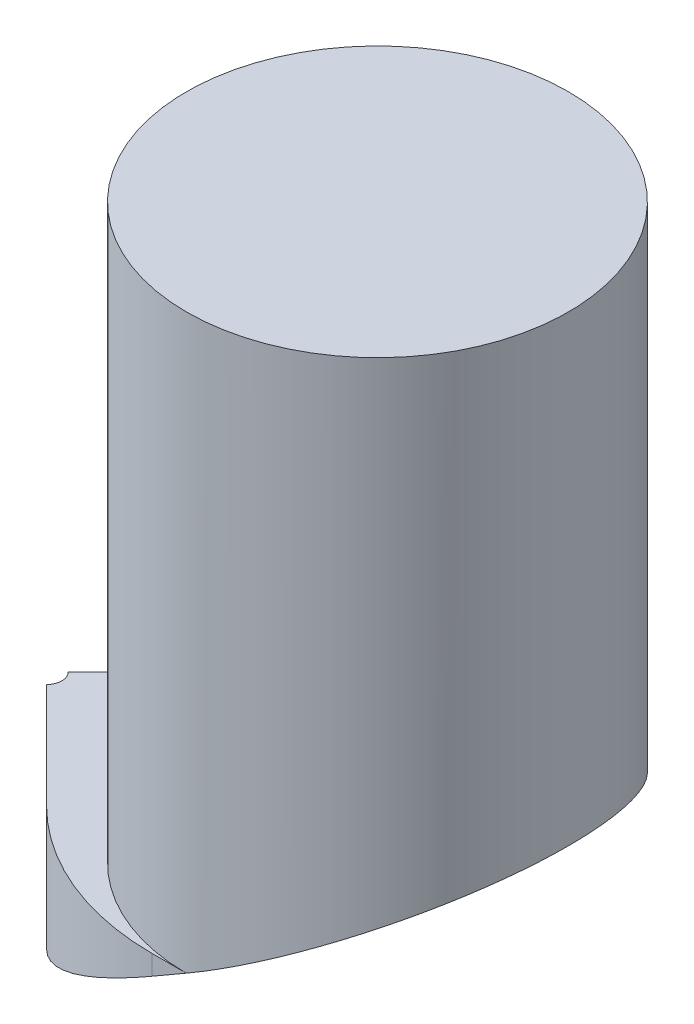
from build123d import *

# Parameters (mm, degrees)
BOSS_EXTRUDE1_DEPTH     = 600
CUT_EXTRUDE1_DEPTH      = 743.024258364
CUT_EXTRUDE1_DEPTH_BACK = 743.024258364
CUT_EXTRUDE2_START      = -450
CUT_EXTRUDE2_DEPTH      = 450
FILLET1_R               = 200


with BuildPart() as part:
    # Sketch1 → Boss-Extrude1 (new body)
    with BuildSketch(Plane(origin=(0, 0, 0), x_dir=(1, 0, 0), z_dir=(0, 1, 0))):
        with BuildLine():
            Line((8.485281374, -8.485281374), (150, -150))
            Line((150, -150), (260, -150))
            ThreePointArc((260, -150), (410, 0), (260, 150))
            Line((260, 150), (150, 150))
            Line((150, 150), (8.485281374, 8.485281374))
            ThreePointArc((8.485281374, 8.485281374), (12, 0), (8.485281374, -8.485281374))
        make_face()
    extrude(amount=BOSS_EXTRUDE1_DEPTH)

    # Sketch2 → Cut-Extrude1 (cut, two sides: drawn at the far end of the back side and taken through both)
    with BuildSketch(Plane.XY.offset(-CUT_EXTRUDE1_DEPTH_BACK)):
        Polygon((0, 0), (410, 236.713610368), (410, 0), align=None)
    extrude(amount=CUT_EXTRUDE1_DEPTH + CUT_EXTRUDE1_DEPTH_BACK, mode=Mode.SUBTRACT)

    # Sketch3 → Cut-Extrude2 (cut)
    with BuildSketch(Plane(origin=(0, 600, 0), x_dir=(1, 0, 0), z_dir=(0, 1, 0)).offset(CUT_EXTRUDE2_START)):
        with BuildLine():
            Line((0, 0), (150, 150))
            Line((150, 150), (260, 150))
            ThreePointArc((260, 150), (110, 0), (260, -150))
            Line((260, -150), (150, -150))
            Line((150, -150), (0, 0))
        make_face()
    extrude(amount=CUT_EXTRUDE2_DEPTH, mode=Mode.SUBTRACT)

    # Fillet1
    fillet1_edges = [part.edges().sort_by_distance(p)[0] for p in [
        (150, 118.301270189, 150),
        (150, 118.301270189, -150),
    ]]
    fillet(fillet1_edges, radius=FILLET1_R)


solid = part.part
